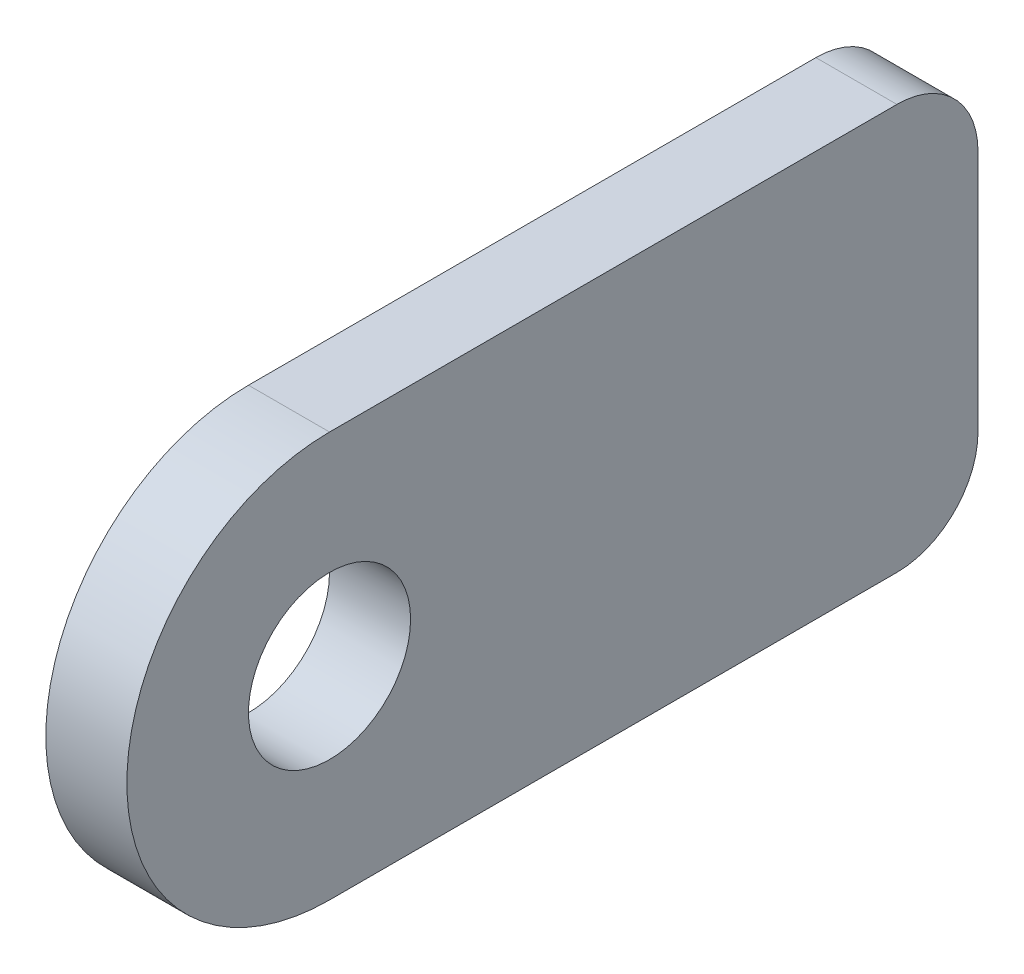
from build123d import *

# Parameters (mm, degrees)
SKETCH1_R           = 10
BOSS_EXTRUDE1_DEPTH = 10
FILLET1_R           = 10


with BuildPart() as part:
    # Sketch1 → Boss-Extrude1 (new body)
    with BuildSketch(Plane(origin=(0, 0, 0), x_dir=(0, 0, -1), z_dir=(1, 0, 0))):
        with BuildLine():
            Line((20, 0), (100, 0))
            Line((100, 0), (100, -50))
            Line((100, -50), (20, -50))
            ThreePointArc((20, -50), (-5, -25), (20, 0))
        make_face()
        with Locations((20, -25)):
            Circle(SKETCH1_R, mode=Mode.SUBTRACT)
    extrude(amount=BOSS_EXTRUDE1_DEPTH)

    # Fillet1
    fillet1_edges = [part.edges().sort_by_distance(p)[0] for p in [
        (5, -50, -100),
        (5, 0, -100),
    ]]
    fillet(fillet1_edges, radius=FILLET1_R)


solid = part.part
